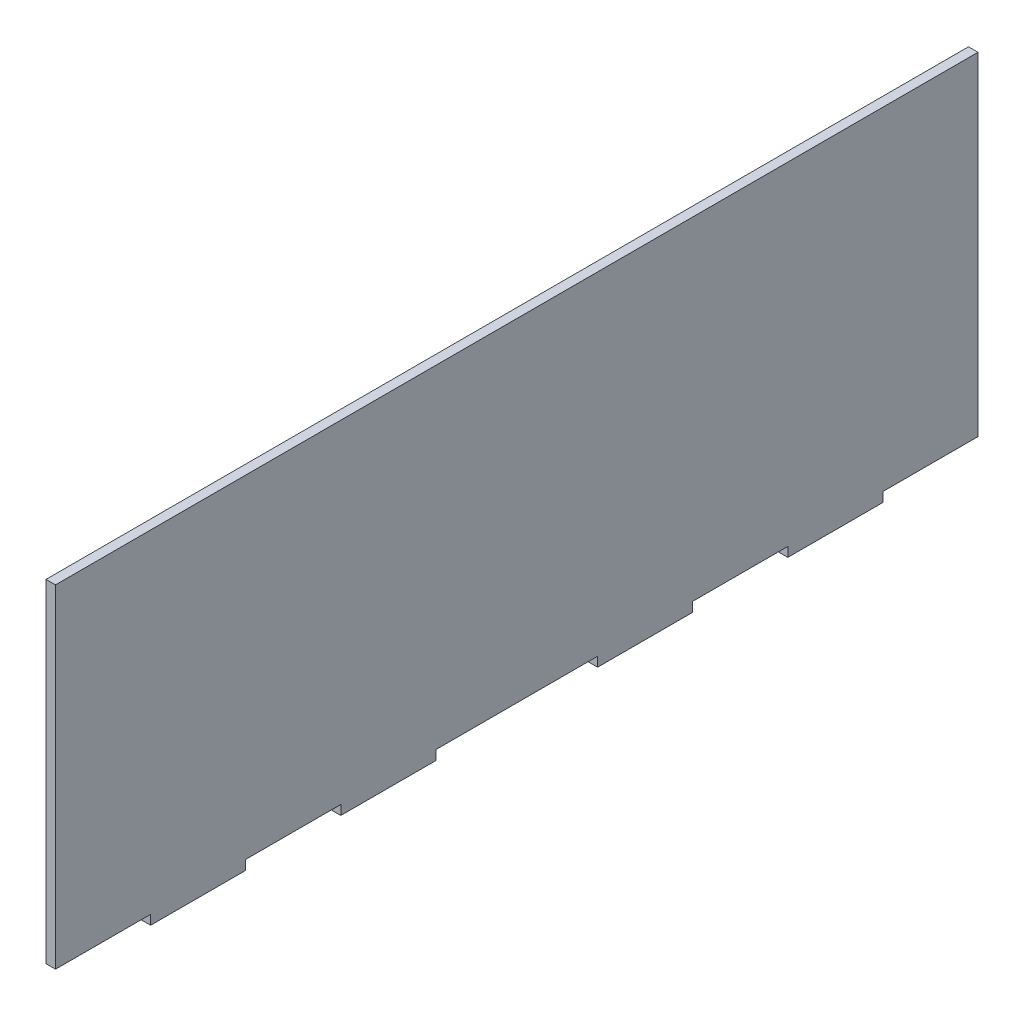
from build123d import *

# Parameters (mm, degrees)
BOSS_EXTRUDE1_DEPTH = 2
SKETCH2_W           = 2
SKETCH2_H           = 20
CUT_EXTRUDE1_DEPTH  = 10
SKETCH3_W           = 20
SKETCH3_H           = 2
BOSS_EXTRUDE2_DEPTH = 2


with BuildPart() as part:
    # Sketch1 → Boss-Extrude1 (new body)
    with BuildSketch(Plane(origin=(0, 0, 0), x_dir=(0, 0, -1), z_dir=(1, 0, 0))):
        Polygon((-97, -35), (97, -35), (97, 0), (99, 0), (99, 20), (97, 20), (97, 35), (-97, 35), (-97, 20), (-99, 20), (-99, 0), (-97, 0), align=None)
    extrude(amount=BOSS_EXTRUDE1_DEPTH)

    # Sketch2 → Cut-Extrude1 (cut)
    with BuildSketch(Plane(origin=(2, 0, 0), x_dir=(0, 0, -1), z_dir=(1, 0, 0))):
        with Locations((-98, 10)):
            Rectangle(SKETCH2_W, SKETCH2_H)
        with Locations((98, 10)):
            Rectangle(SKETCH2_W, SKETCH2_H)
    extrude(amount=-CUT_EXTRUDE1_DEPTH, mode=Mode.SUBTRACT)

    # Sketch3 → Boss-Extrude2 (add)
    with BuildSketch(Plane(origin=(2, 0, 0), x_dir=(0, 0, -1), z_dir=(1, 0, 0))):
        with Locations((-67, -36)):
            Rectangle(SKETCH3_W, SKETCH3_H)
        with Locations((-27, -36)):
            Rectangle(SKETCH3_W, SKETCH3_H)
        with Locations((27, -36)):
            Rectangle(SKETCH3_W, SKETCH3_H)
        with Locations((67, -36)):
            Rectangle(SKETCH3_W, SKETCH3_H)
    extrude(amount=-BOSS_EXTRUDE2_DEPTH)


solid = part.part
